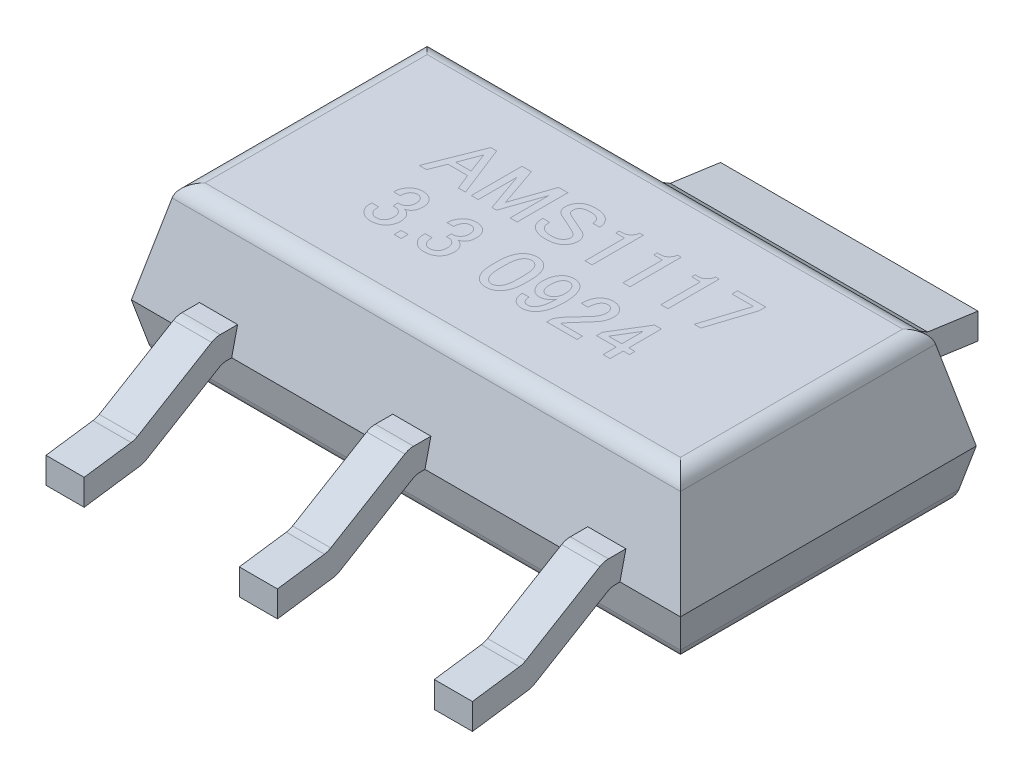
from build123d import *

# Parameters (mm, degrees)
SKETCH5_W           = 6.505
SKETCH5_H           = 3.505
BOSS_EXTRUDE1_DEPTH = 1.2
BOSS_EXTRUDE1_TAPER = 13
SKETCH5_2_W         = 6.505
SKETCH5_2_H         = 3.505
BOSS_EXTRUDE2_DEPTH = 0.6
BOSS_EXTRUDE2_DRAFT = -13
BOSS_EXTRUDE3_DEPTH = 0.226
BOSS_EXTRUDE4_DEPTH = 1.525
BOSS_EXTRUDE5_DEPTH = 0.226
BOSS_EXTRUDE6_DEPTH = 0.226
FILLET1_R           = 0.2
FILLET2_R           = 0.2


with BuildPart() as part:
    # Sketch5 → Boss-Extrude1 (new body)
    with BuildSketch(Plane(origin=(0, 0, 0), x_dir=(1, 0, 0), z_dir=(0, 1, 0))):
        Rectangle(SKETCH5_W, SKETCH5_H)
    extrude(amount=BOSS_EXTRUDE1_DEPTH, taper=BOSS_EXTRUDE1_TAPER)


with BuildPart() as boss_extrude2_tool:
    # Sketch5<2> → Boss-Extrude2 (with draft: the straight prism first)
    with BuildSketch(Plane(origin=(0, 0, 0), x_dir=(1, 0, 0), z_dir=(0, 1, 0))):
        Rectangle(SKETCH5_2_W, SKETCH5_2_H)
    extrude(amount=-BOSS_EXTRUDE2_DEPTH)
    # Boss-Extrude2: the draft: its side faces are tilted about the plane it starts from
    boss_extrude2_sides = [boss_extrude2_tool.faces().sort_by_distance(p)[0] for p in [
        (-3.2525, -0.3, 0),
        (0, -0.3, 1.7525),
        (3.2525, -0.3, 0),
        (0, -0.3, -1.7525),
    ]]
    draft(boss_extrude2_sides, Plane(origin=(0, 0, 0), x_dir=(1, 0, 0), z_dir=(0, 1, 0)), BOSS_EXTRUDE2_DRAFT)


with BuildPart() as part_1:
    add(part.part)

    # Boss-Extrude2: add boss_extrude2_tool
    add(boss_extrude2_tool.part)

    # Sketch6 → Boss-Extrude3 (add, symmetric)
    with BuildSketch(Plane(origin=(0, 0, 0), x_dir=(0, 0, -1), z_dir=(1, 0, 0))):
        Polygon((-2.903570514, -0.269279893), (-3.5, -0.35310259), (-3.5, -0.6611), (-2.8, -0.562721416), (-1.859056144, 0), (-1.7525, 0), (-1.682085202, 0.305), (-1.943299372, 0.305), align=None)
    boss_extrude3 = extrude(amount=BOSS_EXTRUDE3_DEPTH, both=True)

    # Mirror1: Boss-Extrude3 across plane
    add(boss_extrude3.mirror(Plane.XY))

    # Sketch7 → Boss-Extrude4 (add, symmetric)
    with BuildSketch(Plane(origin=(0, 0, 0), x_dir=(0, 0, -1), z_dir=(1, 0, 0))):
        Polygon((2.903570514, -0.269279893), (1.943299372, 0.305), (1.682085202, 0.305), (1.7525, 0), (1.859056144, 0), (2.8, -0.562721416), (3.5, -0.6611), (3.5, -0.35310259), align=None)
    extrude(amount=BOSS_EXTRUDE4_DEPTH, both=True)

    # Sketch8 → Boss-Extrude5 (add, symmetric)
    with BuildSketch(Plane.ZY.offset(2.29)):
        Polygon((1.859056144, 0), (2.8, -0.562721416), (3.5, -0.6611), (3.5, -0.35310259), (2.903570514, -0.269279893), (1.943299372, 0.305), (1.682085202, 0.305), (1.7525, 0), align=None)
    extrude(amount=BOSS_EXTRUDE5_DEPTH, both=True)

    # Sketch9 → Boss-Extrude6 (add, symmetric)
    with BuildSketch(Plane(origin=(2.31, 0, 0), x_dir=(0, 0, -1), z_dir=(1, 0, 0))):
        Polygon((-2.8, -0.562721416), (-1.859056144, 0), (-1.7525, 0), (-1.682085202, 0.305), (-1.943299372, 0.305), (-2.903570514, -0.269279893), (-3.5, -0.35310259), (-3.5, -0.6611), align=None)
    extrude(amount=BOSS_EXTRUDE6_DEPTH, both=True)

    # Fillet1
    fillet1_edges = [part_1.edges().sort_by_distance(p)[0] for p in [
        (-2.975458171, 1.2, 0),
        (0, 1.2, -1.475458171),
        (0, 1.2, 1.475458171),
        (2.975458171, 1.2, 0),
        (-3.113979085, -0.6, 0),
        (0, -0.6, -1.613979085),
        (0, -0.6, 1.613979085),
        (3.113979085, -0.6, 0),
    ]]
    fillet(fillet1_edges, radius=FILLET1_R)

    # Fillet2
    fillet2_edges = [part_1.edges().sort_by_distance(p)[0] for p in [
        (0, -0.562721416, -2.8),
        (0, 0, -1.859056144),
        (-2.29, -0.562721416, 2.8),
        (-2.29, 0, 1.859056144),
        (0, -0.562721416, 2.8),
        (0, 0, 1.859056144),
        (2.31, -0.562721416, 2.8),
        (2.31, 0, 1.859056144),
        (-2.29, 0.305, 1.943299372),
        (-2.29, -0.269279893, 2.903570514),
        (0, 0.305, 1.943299372),
        (0, -0.269279893, 2.903570514),
        (2.31, -0.269279893, 2.903570514),
        (2.31, 0.305, 1.943299372),
    ]]
    fillet(fillet2_edges, radius=FILLET2_R)


solid = part_1.part
